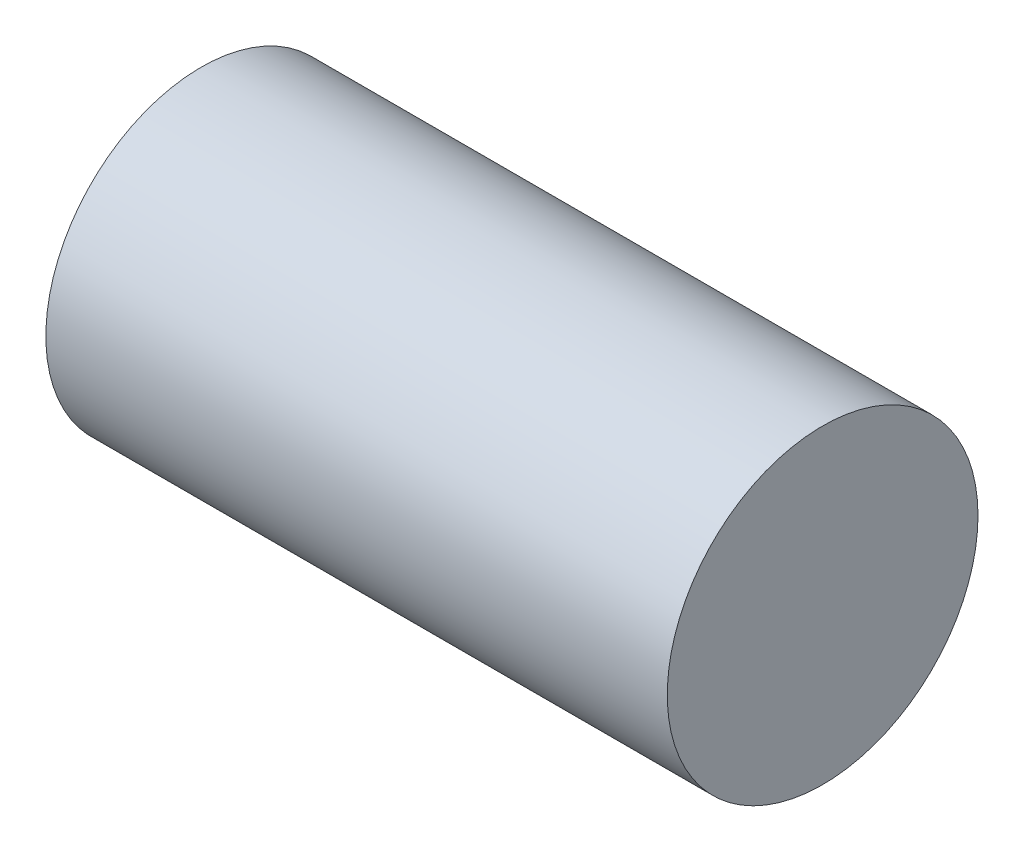
from build123d import *

# Parameters (mm, degrees)
SKETCH1_R           = 7.5
BOSS_EXTRUDE1_DEPTH = 30


with BuildPart() as part:
    # Sketch1 → Boss-Extrude1 (new body)
    with BuildSketch(Plane(origin=(0, 0, 0), x_dir=(0, 0, -1), z_dir=(1, 0, 0))):
        Circle(SKETCH1_R)
    extrude(amount=BOSS_EXTRUDE1_DEPTH)


solid = part.part
